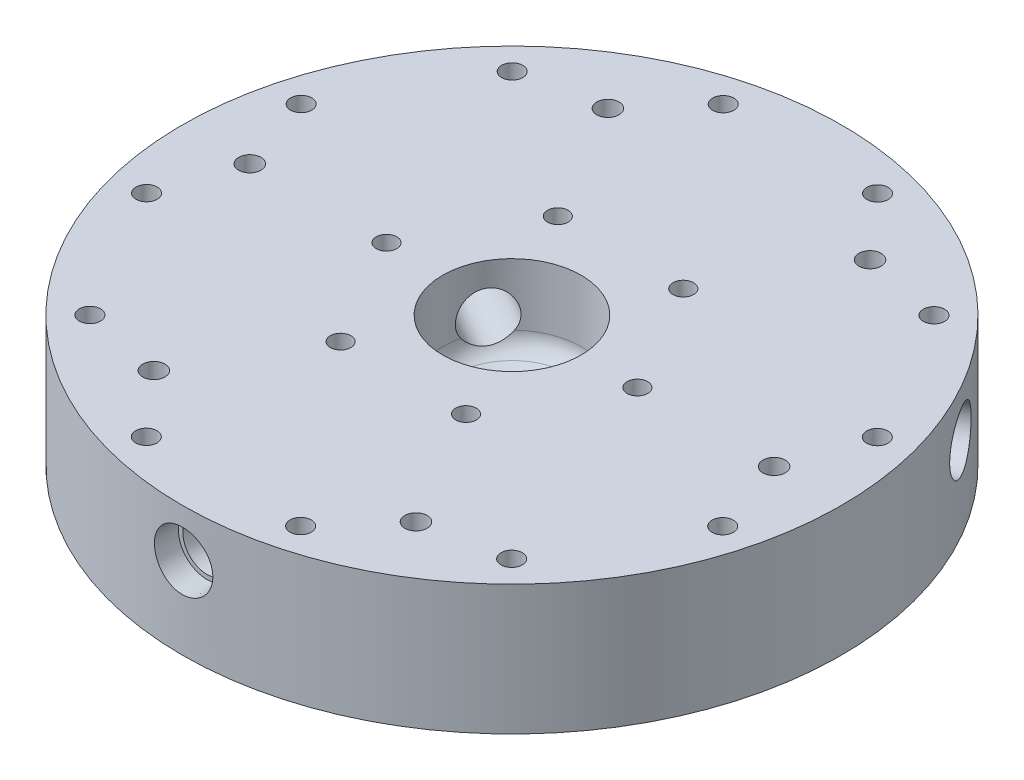
from build123d import *

# Parameters (mm, degrees)
SKETCH1_R                    = 76.2
BOSS_EXTRUDE1_DEPTH          = 30
CIRPATTERN1_COUNT            = 3
F_10_0_1935_DIAMETER_HOLE1_D = 4.9149
CIRPATTERN2_COUNT            = 12
CIRPATTERN3_COUNT            = 6
SKETCH21_W                   = 5
SKETCH21_H                   = 3
CIRPATTERN4_COUNT            = 6
SKETCH29_R                   = 55.14
SKETCH29_R_2                 = 5.953252
BOSS_EXTRUDE2_DEPTH          = 2


with BuildPart() as part:
    # Sketch1 → Boss-Extrude1 (new body)
    with BuildSketch(Plane(origin=(0, 0, 0), x_dir=(1, 0, 0), z_dir=(0, 1, 0))):
        with Locations(Location((0, 0, 0), (0, 0, 270))):
            Circle(SKETCH1_R)
    extrude(amount=BOSS_EXTRUDE1_DEPTH)

    # Sketch2 → Cut-Revolve1 (revolve, cut)
    with BuildSketch(Plane.XY):
        with BuildLine():
            Line((-5.953252, 0), (-5.953252, 4.113248654))
            ThreePointArc((-5.953252, 4.113248654), (-6.623124981, 6.613248654), (-8.453252, 8.443375673))
            Line((-8.453252, 8.443375673), (-13.5, 11.357116989))
            ThreePointArc((-13.5, 11.357116989), (-15.330127019, 13.187244008), (-16, 15.687244008))
            Line((-16, 15.687244008), (-16, 30))
            Line((-16, 30), (0, 30))
            Line((0, 30), (0, 0))
            Line((0, 0), (-5.953252, 0))
        make_face()
    revolve(axis=Axis((0, 30, 0), (0, -1, 0)), mode=Mode.SUBTRACT)

    # Sketch5 → 1/4 NPT Tapped Hole1 (revolve, cut)
    with BuildSketch(Plane(origin=(0, 18.904757199, 80.54), x_dir=(0, -1, 0), z_dir=(1, 0, 0))):
        Polygon((0, 0), (0, 83.882347279), (5.5626, 80.54), (5.5626, 10.02), (6.58554395, 10.02), (6.8579873, 0.9207627), (7.77875, 0), align=None)
    f_1_4_npt_tapped_hole1 = revolve(axis=Axis((0, 18.904757199, 86.89), (0, 0, -1)), mode=Mode.SUBTRACT)

    # CirPattern1: 1/4 NPT Tapped Hole1 ×3 about axis
    cirpattern1_axis = Axis((0, 0, 0), (0, 1, 0))
    for i in range(1, CIRPATTERN1_COUNT):
        add(f_1_4_npt_tapped_hole1.rotate(cirpattern1_axis, i * 360 / CIRPATTERN1_COUNT), mode=Mode.SUBTRACT)

    # #10 (0.1935) Diameter Hole1 (through all)
    with Locations(Plane(origin=(0, 30, 0), x_dir=(1, 0, 0), z_dir=(0, 1, 0))):
        with Locations((-17.814475001, 66.660666667)):
            f_10_0_1935_diameter_hole1 = Hole(F_10_0_1935_DIAMETER_HOLE1_D / 2)

    # CirPattern2: #10 (0.1935) Diameter Hole1 ×12 about axis
    cirpattern2_axis = Axis((0, 0, 0), (0, 1, 0))
    for i in range(1, CIRPATTERN2_COUNT):
        add(f_10_0_1935_diameter_hole1.rotate(cirpattern2_axis, i * 360 / CIRPATTERN2_COUNT), mode=Mode.SUBTRACT)

    # Sketch19 → 13/64 (0.20313) Diameter Hole3 (revolve, cut)
    with BuildSketch(Plane(origin=(30.305, 30, -52.489799723), x_dir=(0, 0, 1), z_dir=(1, 0, 0))):
        Polygon((0, 0), (0, 14.250070783), (2.579751, 12.7), (2.579751, 0), align=None)
    f_13_64_0_20313_diameter_hole3 = revolve(axis=Axis((30.305, 36.35, -52.489799723), (0, -1, 0)), mode=Mode.SUBTRACT)

    # CirPattern3: 13/64 (0.20313) Diameter Hole3 ×6 about axis
    cirpattern3_axis = Axis((0, 0, 0), (0, 1, 0))
    for i in range(1, CIRPATTERN3_COUNT):
        add(f_13_64_0_20313_diameter_hole3.rotate(cirpattern3_axis, i * 360 / CIRPATTERN3_COUNT), mode=Mode.SUBTRACT)

    # Sketch21 → Cut-Revolve2 (revolve, cut)
    with BuildSketch(Plane.XY, mode=Mode.PRIVATE) as cut_revolve2_sk:
        with Locations((62.5, 1.5)):
            Rectangle(SKETCH21_W, SKETCH21_H)
    revolve(cut_revolve2_sk.sketch.rotate(Axis((0, 0, 0), (0, -1, 0)), 90), axis=Axis((0, 0, 0), (0, -1, 0)), mode=Mode.SUBTRACT)

    # Sketch28 → 3/16 (0.1875) Diameter Hole1 (revolve, cut)
    with BuildSketch(Plane(origin=(29, 30, 0), x_dir=(0, 0, 1), z_dir=(1, 0, 0))):
        Polygon((0, 0), (0, 13.430799349), (2.38125, 12), (2.38125, 0), align=None)
    f_3_16_0_1875_diameter_hole1 = revolve(axis=Axis((29, 36.35, 0), (0, -1, 0)), mode=Mode.SUBTRACT)

    # CirPattern4: 3/16 (0.1875) Diameter Hole1 ×6 about axis
    cirpattern4_axis = Axis((0, 0, 0), (0, 1, 0))
    for i in range(1, CIRPATTERN4_COUNT):
        add(f_3_16_0_1875_diameter_hole1.rotate(cirpattern4_axis, i * 360 / CIRPATTERN4_COUNT), mode=Mode.SUBTRACT)

    # Sketch29 → Boss-Extrude2 (add)
    with BuildSketch(Plane(origin=(0, 0, 0), x_dir=(-1, 0, 0), z_dir=(0, -1, 0))):
        with Locations(Location((0, 0, 0), (0, 0, 90))):
            Circle(SKETCH29_R)
        Circle(SKETCH29_R_2, mode=Mode.SUBTRACT)
    extrude(amount=BOSS_EXTRUDE2_DEPTH)


solid = part.part
